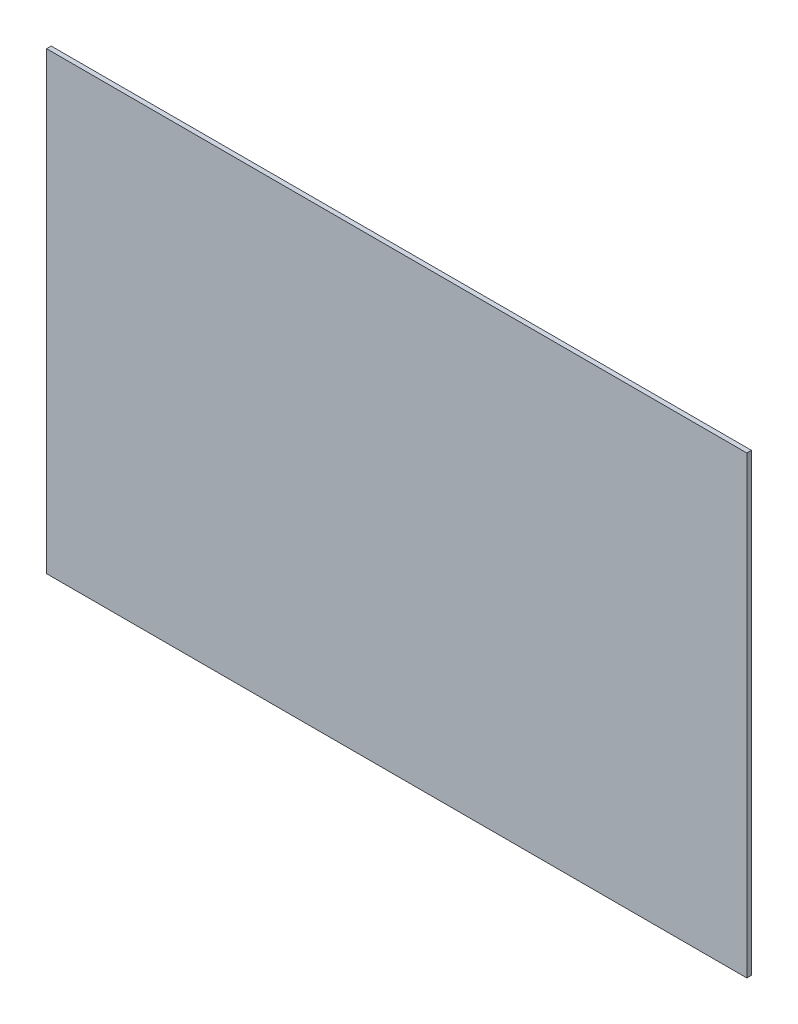
from build123d import *

# Parameters (mm, degrees)
SKETCH2_W           = 1500
SKETCH2_H           = 500
BOSS_EXTRUDE1_DEPTH = 10
SKETCH3_W           = 3000
SKETCH3_H           = 2000
BOSS_EXTRUDE2_DEPTH = 10
CUT_EXTRUDE1_DEPTH  = 10


with BuildPart() as part:
    # Sketch2 → Boss-Extrude1 (new body)
    with BuildSketch(Plane.XY):
        with Locations((750, 250)):
            Rectangle(SKETCH2_W, SKETCH2_H)
    extrude(amount=BOSS_EXTRUDE1_DEPTH)

    # Sketch3 → Boss-Extrude2 (add)
    with BuildSketch(Plane.XY.offset(10)):
        with Locations((1500, -500)):
            Rectangle(SKETCH3_W, SKETCH3_H)
    extrude(amount=-BOSS_EXTRUDE2_DEPTH)

    # Sketch4 → Cut-Extrude1 (cut)
    with BuildSketch(Plane.XY.offset(10)):
        Polygon((1517.1, -515), (1517.1, -1500), (3000, -1500), (3000, 500), (0, 500), (0, -515), align=None)
    extrude(amount=-CUT_EXTRUDE1_DEPTH, mode=Mode.SUBTRACT)


solid = part.part
